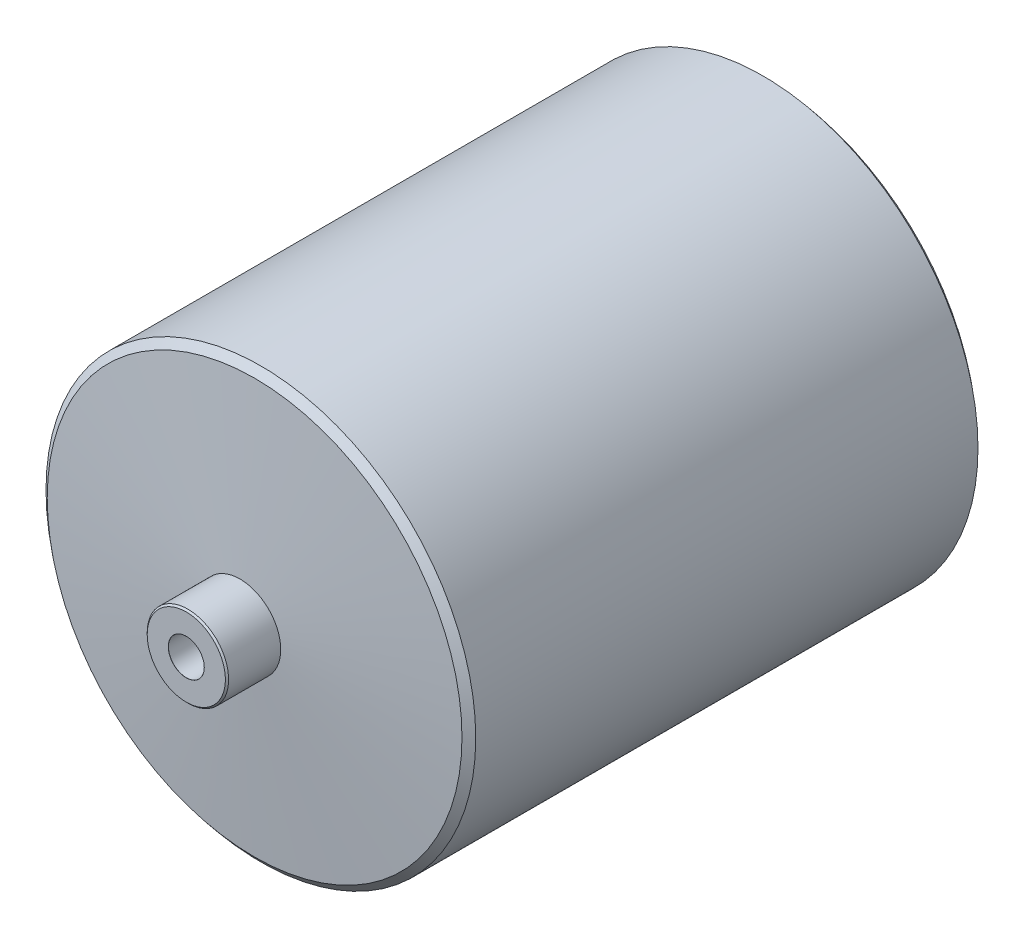
from build123d import *

# Parameters (mm, degrees)
M10_CLEARANCE_HOLE2_D                     = 11
M10_CLEARANCE_HOLE2_DEPTH                 = 55.695266595
M10_CLEARANCE_HOLE2_CSINK_D               = 11.05
M10_CLEARANCE_HOLE2_CSINK_ANGLE           = 90
M10_CLEARANCE_HOLE2_TIP                   = 3.304733405
M10_CLEARANCE_HOLE2_ON_FACE_2_D           = 11
M10_CLEARANCE_HOLE2_ON_FACE_2_DEPTH       = 55.695266595
M10_CLEARANCE_HOLE2_ON_FACE_2_CSINK_D     = 11.05
M10_CLEARANCE_HOLE2_ON_FACE_2_CSINK_ANGLE = 90
M10_CLEARANCE_HOLE2_ON_FACE_2_TIP         = 3.304733405
CHAMFER1_SIZE                             = 0.5


with BuildPart() as part:
    # Sketch1 → Revolve1 (revolve)
    with BuildSketch(Plane(origin=(0, 0, 0), x_dir=(0, 0, -1), z_dir=(1, 0, 0)), mode=Mode.PRIVATE) as revolve1_sk:
        Polygon((-100, 0), (100, 0), (100, 12.5), (83.5, 12.5), (79.023440019, 63.66731472), (77.097512539, 65.967489352), (-77.097512539, 65.967489352), (-79.023440019, 63.66731472), (-83.5, 12.5), (-100, 12.5), align=None)
    revolve(revolve1_sk.sketch.rotate(Axis((0, 0, 100), (0, 0, -1)), 90), axis=Axis((0, 0, 100), (0, 0, -1)))

    # M10 Clearance Hole2
    with Locations(Plane(origin=(0, 0, -100), x_dir=(-1, 0, 0), z_dir=(0, 0, -1))):
        with Locations((0, 0)):
            CounterSinkHole(M10_CLEARANCE_HOLE2_D / 2, M10_CLEARANCE_HOLE2_CSINK_D / 2, depth=M10_CLEARANCE_HOLE2_DEPTH, counter_sink_angle=M10_CLEARANCE_HOLE2_CSINK_ANGLE)
            with Locations((0, 0, -(M10_CLEARANCE_HOLE2_DEPTH + M10_CLEARANCE_HOLE2_TIP / 2))):  # 118° drill point
                Cone(0, M10_CLEARANCE_HOLE2_D / 2, M10_CLEARANCE_HOLE2_TIP, mode=Mode.SUBTRACT)

    # M10 Clearance Hole2 on face 2
    with Locations(Plane.XY.offset(100)):
        with Locations((0, 0)):
            CounterSinkHole(M10_CLEARANCE_HOLE2_ON_FACE_2_D / 2, M10_CLEARANCE_HOLE2_ON_FACE_2_CSINK_D / 2, depth=M10_CLEARANCE_HOLE2_ON_FACE_2_DEPTH, counter_sink_angle=M10_CLEARANCE_HOLE2_ON_FACE_2_CSINK_ANGLE)
            with Locations((0, 0, -(M10_CLEARANCE_HOLE2_ON_FACE_2_DEPTH + M10_CLEARANCE_HOLE2_ON_FACE_2_TIP / 2))):  # 118° drill point
                Cone(0, M10_CLEARANCE_HOLE2_ON_FACE_2_D / 2, M10_CLEARANCE_HOLE2_ON_FACE_2_TIP, mode=Mode.SUBTRACT)

    # Chamfer1
    chamfer1_edges = [part.edges().sort_by_distance(p)[0] for p in [
        (-12.5, 0, -100),
        (-12.5, 0, 100),
    ]]
    chamfer(chamfer1_edges, length=CHAMFER1_SIZE)


solid = part.part
